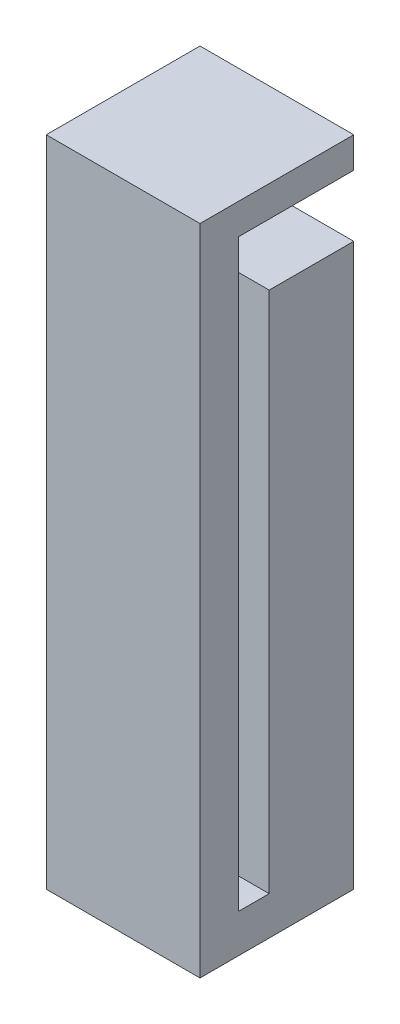
from build123d import *

# Parameters (mm, degrees)
SKETCH1_W           = 10
SKETCH1_H           = 10
BOSS_EXTRUDE1_DEPTH = 40
SKETCH3_W           = 7.5
SKETCH3_H           = 4
CUT_EXTRUDE1_DEPTH  = 7.5
SKETCH4_W           = 2
SKETCH4_H           = 5.5
CUT_EXTRUDE2_DEPTH  = 38
SKETCH5_W           = 10
SKETCH5_H           = 10
BOSS_EXTRUDE2_DEPTH = 2.5
BOSS_EXTRUDE3_REACH = 44.426
SKETCH6_W           = 1
SKETCH6_H           = 2


with BuildPart() as part:
    # Sketch1 → Boss-Extrude1 (new body)
    with BuildSketch(Plane(origin=(0, 0, 0), x_dir=(1, 0, 0), z_dir=(0, 1, 0))):
        with Locations((5, 5)):
            Rectangle(SKETCH1_W, SKETCH1_H)
    extrude(amount=BOSS_EXTRUDE1_DEPTH)

    # Sketch3 → Cut-Extrude1 (cut)
    with BuildSketch(Plane(origin=(0, 0, -10), x_dir=(-1, 0, 0), z_dir=(0, 0, -1))):
        with Locations((-6.25, 36)):
            Rectangle(SKETCH3_W, SKETCH3_H)
    extrude(amount=-CUT_EXTRUDE1_DEPTH, mode=Mode.SUBTRACT)

    # Sketch4 → Cut-Extrude2 (cut)
    with BuildSketch(Plane.XZ):
        Polygon((10, -2.5), (2.5, -2.5), (2.5, -4.5), (4.5, -4.5), (10, -4.5), align=None)
        with Locations((3.5, -7.25)):
            Rectangle(SKETCH4_W, SKETCH4_H)
    extrude(amount=-CUT_EXTRUDE2_DEPTH, mode=Mode.SUBTRACT)


with BuildPart() as cut_extrude2_piece_1:
    # of the separate pieces the step leaves, piece 1, a body of its own (cut_extrude2_pieces)
    add(part.part.solids().sort_by_distance((0, 0, 0))[0])



with BuildPart() as cut_extrude2_piece_2:
    # of the separate pieces the step leaves, piece 2, a body of its own (cut_extrude2_pieces)
    add(part.part.solids().sort_by_distance((10, 0, -4.5))[0])


with BuildPart() as cut_extrude2_piece_1_1:
    add(cut_extrude2_piece_1.part)

    add(cut_extrude2_piece_2.part)  # Boss-Extrude2 merges Cut-Extrude2 piece 2
    # Sketch5 → Boss-Extrude2 (add)
    with BuildSketch(Plane.XZ):
        with Locations((5, -5)):
            Rectangle(SKETCH5_W, SKETCH5_H)
    extrude(amount=BOSS_EXTRUDE2_DEPTH)

    # Boss-Extrude3: up to this face of the body (flat: up to its plane)
    boss_extrude3_end = Plane(cut_extrude2_piece_1_1.part.faces().sort_by_distance((6.25, 38, -6.25))[0])
    # Sketch6 → Boss-Extrude3 (add, up to the picked face)
    with BuildSketch(Plane(origin=(0, 0, 0), x_dir=(1, 0, 0), z_dir=(0, 1, 0)), mode=Mode.PRIVATE) as boss_extrude3_sk1:
        Polygon((3.5, 4.5), (3.5, 2.5), (6.5, 2.5), (6.5, 4.5), (4.5, 4.5), align=None)
    boss_extrude3_tool1 = split(extrude(boss_extrude3_sk1.sketch, amount=BOSS_EXTRUDE3_REACH, mode=Mode.PRIVATE), bisect_by=boss_extrude3_end, keep=Keep.BOTH, mode=Mode.PRIVATE)
    # Sketch6 → Boss-Extrude3 (add, up to the picked face)
    with BuildSketch(Plane(origin=(0, 0, 0), x_dir=(1, 0, 0), z_dir=(0, 1, 0)), mode=Mode.PRIVATE) as boss_extrude3_sk2:
        with Locations((4, 5.5)):
            Rectangle(SKETCH6_W, SKETCH6_H)
    boss_extrude3_tool2 = split(extrude(boss_extrude3_sk2.sketch, amount=BOSS_EXTRUDE3_REACH, mode=Mode.PRIVATE), bisect_by=boss_extrude3_end, keep=Keep.BOTH, mode=Mode.PRIVATE)
    # Sketch6 → Boss-Extrude3 (add, up to the picked face)
    with BuildSketch(Plane(origin=(0, 0, 0), x_dir=(1, 0, 0), z_dir=(0, 1, 0)), mode=Mode.PRIVATE) as boss_extrude3_sk3:
        with Locations((3, 5.5)):
            Rectangle(SKETCH6_W, SKETCH6_H)
    boss_extrude3_tool3 = split(extrude(boss_extrude3_sk3.sketch, amount=BOSS_EXTRUDE3_REACH, mode=Mode.PRIVATE), bisect_by=boss_extrude3_end, keep=Keep.BOTH, mode=Mode.PRIVATE)
    # Sketch6 → Boss-Extrude3 (add, up to the picked face)
    with BuildSketch(Plane(origin=(0, 0, 0), x_dir=(1, 0, 0), z_dir=(0, 1, 0)), mode=Mode.PRIVATE) as boss_extrude3_sk4:
        with Locations((3, 3.5)):
            Rectangle(SKETCH6_W, SKETCH6_H)
    boss_extrude3_tool4 = split(extrude(boss_extrude3_sk4.sketch, amount=BOSS_EXTRUDE3_REACH, mode=Mode.PRIVATE), bisect_by=boss_extrude3_end, keep=Keep.BOTH, mode=Mode.PRIVATE)
    add(boss_extrude3_tool1.solids().sort_by(Axis((5, 0, -3.5), (0, 1, 0)))[0])
    add(boss_extrude3_tool2.solids().sort_by(Axis((4, 0, -5.5), (0, 1, 0)))[0])
    add(boss_extrude3_tool3.solids().sort_by(Axis((3, 0, -5.5), (0, 1, 0)))[0])
    add(boss_extrude3_tool4.solids().sort_by(Axis((3, 0, -3.5), (0, 1, 0)))[0])


solid = cut_extrude2_piece_1_1.part
